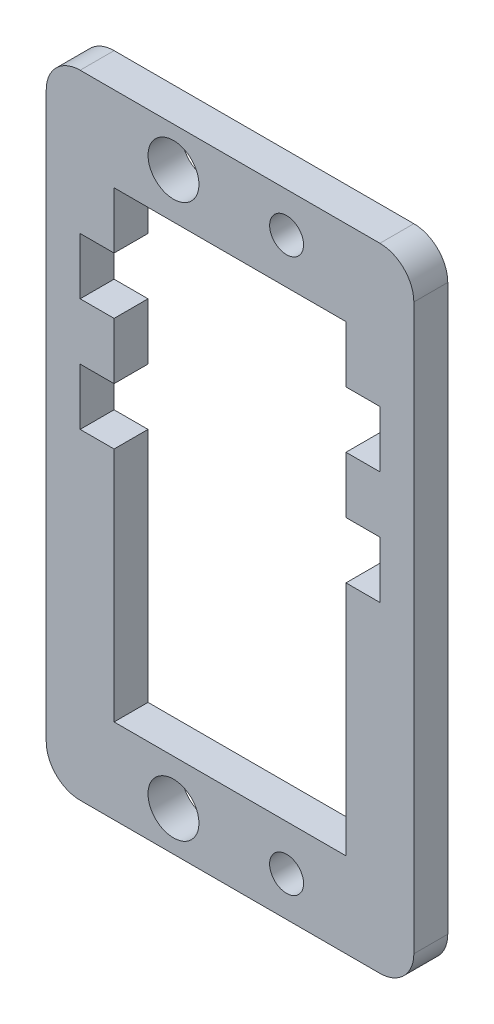
from build123d import *

# Parameters (mm, degrees)
SKETCH1_R           = 2.25
SKETCH1_R_2         = 1.5
BOSS_EXTRUDE1_DEPTH = 3


with BuildPart() as part:
    # Sketch1 → Boss-Extrude1 (new body)
    with BuildSketch(Plane.XY):
        with BuildLine():
            Line((-13.25, 27.95), (13.25, 27.95))
            ThreePointArc((13.25, 27.95), (15.371320344, 27.071320344), (16.25, 24.95))
            Line((16.25, 24.95), (16.25, -24.95))
            ThreePointArc((16.25, -24.95), (15.371320344, -27.071320344), (13.25, -27.95))
            Line((13.25, -27.95), (-13.25, -27.95))
            ThreePointArc((-13.25, -27.95), (-15.371320344, -27.071320344), (-16.25, -24.95))
            Line((-16.25, -24.95), (-16.25, 24.95))
            ThreePointArc((-16.25, 24.95), (-15.371320344, 27.071320344), (-13.25, 27.95))
        make_face()
        with Locations((-5, 24.45)):
            Circle(SKETCH1_R, mode=Mode.SUBTRACT)
        with Locations((5, 24.45)):
            Circle(SKETCH1_R_2, mode=Mode.SUBTRACT)
        with Locations(Location((5, -24.45, 0), (0, 0, 180))):
            Circle(SKETCH1_R_2, mode=Mode.SUBTRACT)
        with Locations(Location((-5, -24.45, 0), (0, 0, 180))):
            Circle(SKETCH1_R, mode=Mode.SUBTRACT)
        Polygon((-10.25, 20.45), (10.25, 20.45), (10.25, 15.45), (13.25, 15.45), (13.25, 10.45), (10.25, 10.45), (10.25, 5.45), (13.25, 5.45), (13.25, 0.45), (10.25, 0.45), (10.25, -20.45), (-10.25, -20.45), (-10.25, 0.45), (-13.25, 0.45), (-13.25, 5.45), (-10.25, 5.45), (-10.25, 10.45), (-13.25, 10.45), (-13.25, 15.45), (-10.25, 15.45), align=None, mode=Mode.SUBTRACT)
    extrude(amount=BOSS_EXTRUDE1_DEPTH)


solid = part.part
